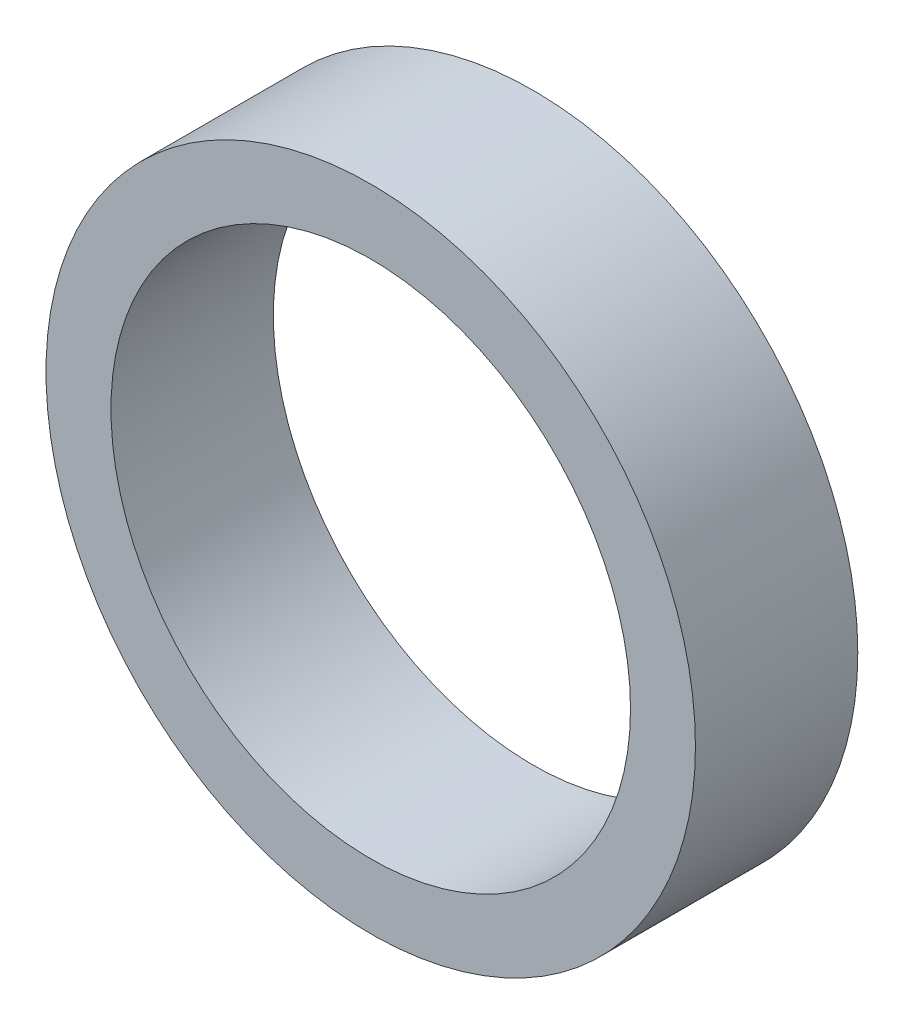
from build123d import *

# Parameters (mm, degrees)
SKETCH_1_R      = 2
SKETCH_1_R_2    = 1.6
EXTRUDE_1_DEPTH = 1


with BuildPart() as part:
    # 草图1 → 凸台-拉伸1 (new body)
    with BuildSketch(Plane.XY):
        Circle(SKETCH_1_R)
        Circle(SKETCH_1_R_2, mode=Mode.SUBTRACT)
    extrude(amount=EXTRUDE_1_DEPTH)


solid = part.part
